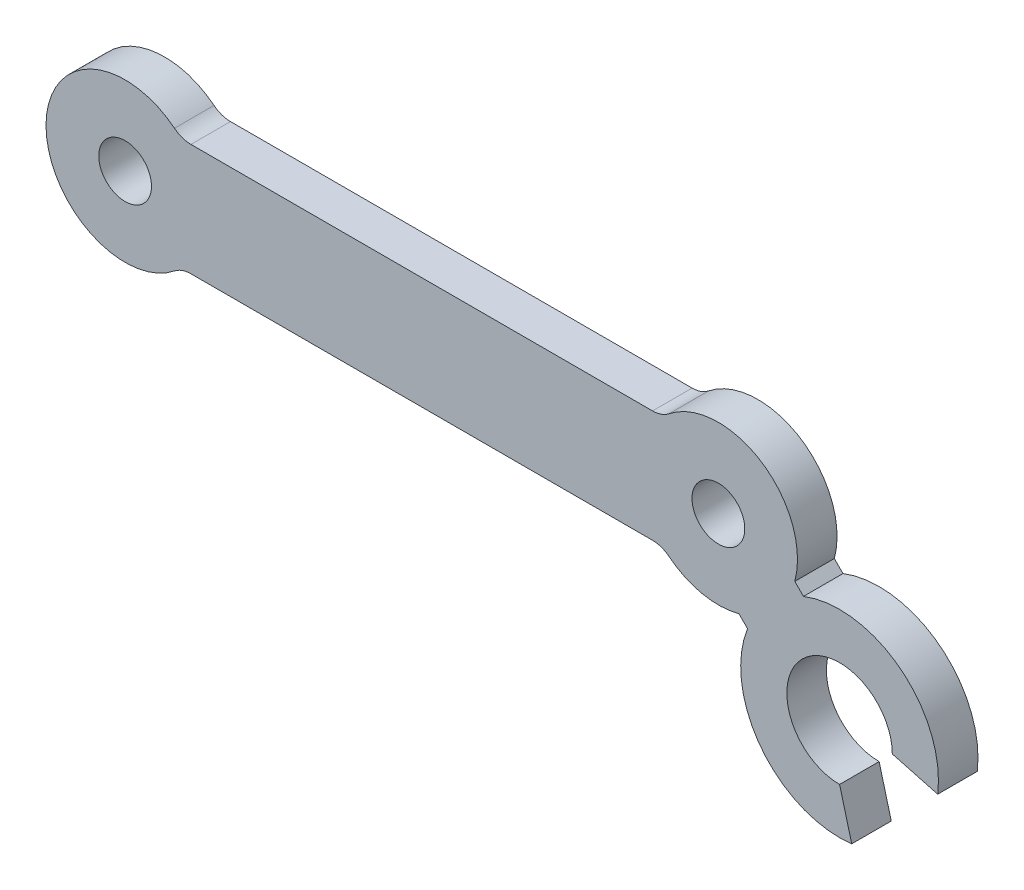
from build123d import *

# Parameters (mm, degrees)
SKETCH_1_R      = 2
EXTRUDE_1_DEPTH = 3


with BuildPart() as part:
    # 草图1 → 凸台-拉伸1 (new body)
    with BuildSketch(Plane.XY):
        with BuildLine():
            Line((4.993746089, 4.25), (40.006253911, 4.25))
            ThreePointArc((40.006253911, 4.25), (40.667691739, 4.362541391), (41.254690433, 4.6875))
            ThreePointArc((41.254690433, 4.6875), (48.284291264, 5.02129773), (50.795554958, -1.552914271))
            Line((50.795554958, -1.552914271), (51.01040764, -1.767766953))
            Line((51.01040764, -1.767766953), (51.453152975, -2.210512288))
            ThreePointArc((51.453152975, -2.210512288), (58.791461904, -3.267987709), (61.635430691, -10.114948622))
            Line((61.635430691, -10.114948622), (58.192388155, -9.192388155))
            ThreePointArc((58.192388155, -9.192388155), (51.363961031, -6.363961031), (54.192388155, -13.192388155))
            Line((54.192388155, -13.192388155), (55.114948622, -16.635430691))
            ThreePointArc((55.114948622, -16.635430691), (48.267987709, -13.791461904), (47.210512288, -6.453152975))
            Line((47.210512288, -6.453152975), (46.767766953, -6.01040764))
            Line((46.767766953, -6.01040764), (46.552914271, -5.795554958))
            ThreePointArc((46.552914271, -5.795554958), (43.771750949, -5.872938299), (41.254690433, -4.6875))
            ThreePointArc((41.254690433, -4.6875), (40.667691739, -4.362541391), (40.006253911, -4.25))
            Line((40.006253911, -4.25), (4.993746089, -4.25))
            ThreePointArc((4.993746089, -4.25), (4.332308261, -4.362541391), (3.745309567, -4.6875))
            ThreePointArc((3.745309567, -4.6875), (-6, 0), (3.745309567, 4.6875))
            ThreePointArc((3.745309567, 4.6875), (4.332308261, 4.362541391), (4.993746089, 4.25))
        make_face()
        Circle(SKETCH_1_R, mode=Mode.SUBTRACT)
        with Locations(Location((45, 0, 0), (0, 0, 180))):
            Circle(SKETCH_1_R, mode=Mode.SUBTRACT)
    extrude(amount=EXTRUDE_1_DEPTH)


solid = part.part
